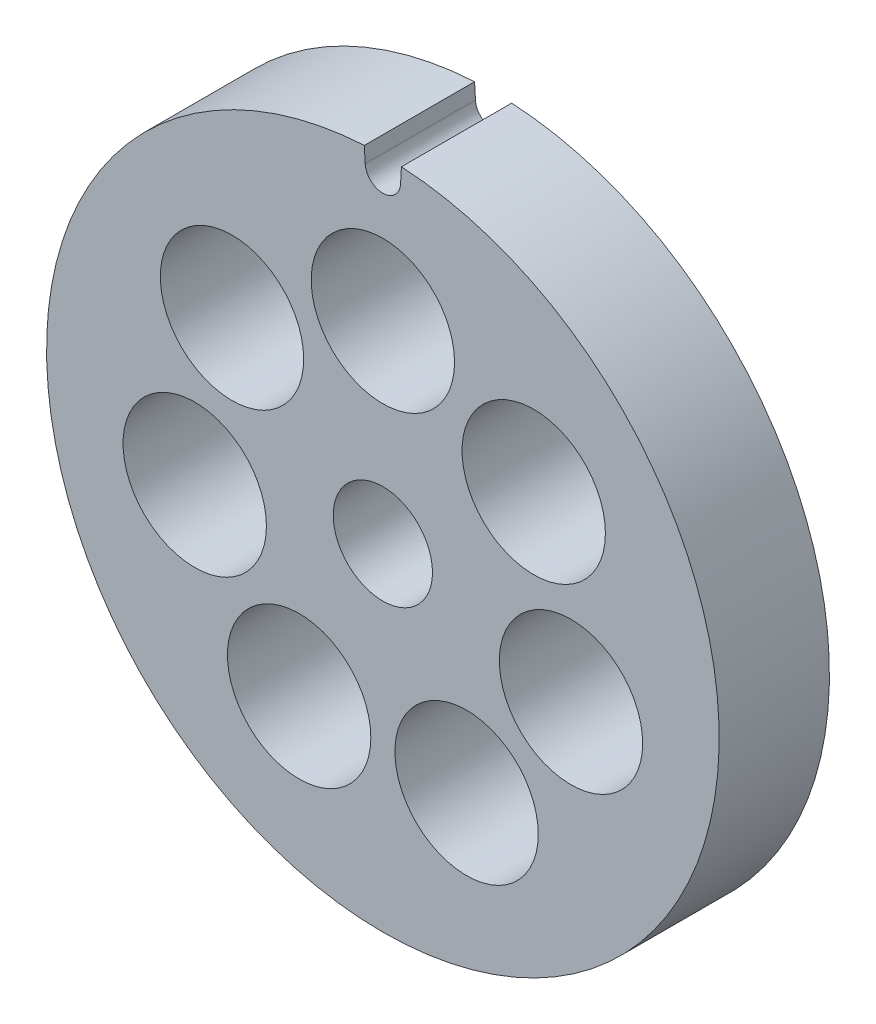
from build123d import *

# Parameters (mm, degrees)
SZKIC1_R                    = 4.5
SZKIC1_R_2                  = 6.5
DODANIE_WYCI_GNI_CIE1_DEPTH = 10


with BuildPart() as part:
    # Szkic1 → Dodanie-wyciągnięcie1 (new body)
    with BuildSketch(Plane.XY):
        with BuildLine():
            Line((1.680612664, 30.453662195), (1.603352408, 29.053662195))
            ThreePointArc((1.603352408, 29.053662195), (0, 27.536352592), (-1.603352408, 29.053662195))
            Line((-1.603352408, 29.053662195), (-1.680612664, 30.453662195))
            ThreePointArc((-1.680612664, 30.453662195), (0, -30.5), (1.680612664, 30.453662195))
        make_face()
        Circle(SZKIC1_R, mode=Mode.SUBTRACT)
        with Locations((0, 17.5)):
            Circle(SZKIC1_R_2, mode=Mode.SUBTRACT)
        with Locations((13.682050943, 10.911071533)):
            Circle(SZKIC1_R_2, mode=Mode.SUBTRACT)
        with Locations((17.061238463, -3.894116344)):
            Circle(SZKIC1_R_2, mode=Mode.SUBTRACT)
        with Locations((7.592965435, -15.766955188)):
            Circle(SZKIC1_R_2, mode=Mode.SUBTRACT)
        with Locations((-7.592965435, -15.766955188)):
            Circle(SZKIC1_R_2, mode=Mode.SUBTRACT)
        with Locations((-17.061238463, -3.894116344)):
            Circle(SZKIC1_R_2, mode=Mode.SUBTRACT)
        with Locations((-13.682050943, 10.911071533)):
            Circle(SZKIC1_R_2, mode=Mode.SUBTRACT)
    extrude(amount=DODANIE_WYCI_GNI_CIE1_DEPTH)


solid = part.part
